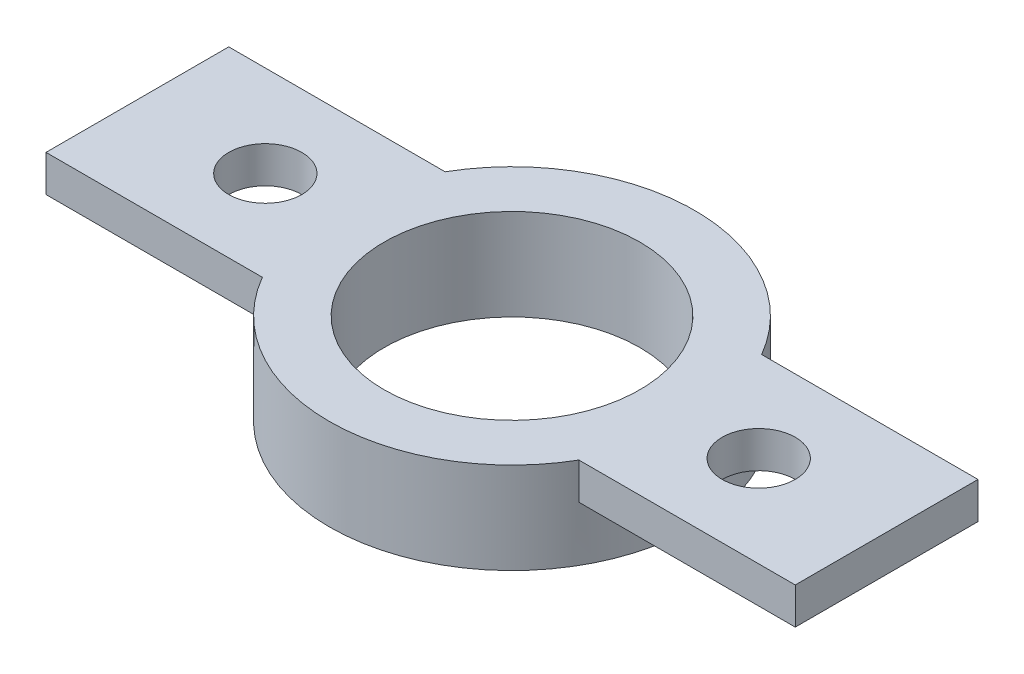
from build123d import *

# Parameters (mm, degrees)
SKETCH1_W           = 35
SKETCH1_H           = 10
BOSS_EXTRUDE1_DEPTH = 2
SKETCH2_R           = 10
BOSS_EXTRUDE2_DEPTH = 5
SKETCH3_R           = 7
CUT_EXTRUDE1_DEPTH  = 2000
SKETCH4_R           = 2
CUT_EXTRUDE2_DEPTH  = 20
SKETCH5_W           = 10
SKETCH5_H           = 2
BOSS_EXTRUDE3_DEPTH = 3
SKETCH6_W           = 10
SKETCH6_H           = 2
BOSS_EXTRUDE4_DEPTH = 3


with BuildPart() as part:
    # Sketch1 → Boss-Extrude1 (new body)
    with BuildSketch(Plane(origin=(0, 0, 0), x_dir=(1, 0, 0), z_dir=(0, 1, 0))):
        with Locations((17.5, 5)):
            Rectangle(SKETCH1_W, SKETCH1_H)
    extrude(amount=BOSS_EXTRUDE1_DEPTH)

    # Sketch2 → Boss-Extrude2 (add)
    with BuildSketch(Plane(origin=(0, 2, 0), x_dir=(1, 0, 0), z_dir=(0, 1, 0))):
        with Locations(Location((17.5, 5, 0), (0, 0, 270))):
            Circle(SKETCH2_R)
    extrude(amount=-BOSS_EXTRUDE2_DEPTH)

    # Sketch3 → Cut-Extrude1 (cut)
    with BuildSketch(Plane(origin=(0, 2, 0), x_dir=(1, 0, 0), z_dir=(0, 1, 0))):
        with Locations(Location((17.5, 5, 0), (0, 0, 270))):
            Circle(SKETCH3_R)
    extrude(amount=-CUT_EXTRUDE1_DEPTH, mode=Mode.SUBTRACT)

    # Sketch4 → Cut-Extrude2 (cut)
    with BuildSketch(Plane.XZ):
        with Locations(Location((4, -5, 0), (0, 0, 270))):
            Circle(SKETCH4_R)
        with Locations(Location((31, -5, 0), (0, 0, 270))):
            Circle(SKETCH4_R)
    extrude(amount=-CUT_EXTRUDE2_DEPTH, mode=Mode.SUBTRACT)

    # Sketch5 → Boss-Extrude3 (add)
    with BuildSketch(Plane.ZY):
        with Locations((-5, 1)):
            Rectangle(SKETCH5_W, SKETCH5_H)
    extrude(amount=BOSS_EXTRUDE3_DEPTH)

    # Sketch6 → Boss-Extrude4 (add)
    with BuildSketch(Plane(origin=(35, 0, 0), x_dir=(0, 0, -1), z_dir=(1, 0, 0))):
        with Locations((5, 1)):
            Rectangle(SKETCH6_W, SKETCH6_H)
    extrude(amount=BOSS_EXTRUDE4_DEPTH)


solid = part.part
